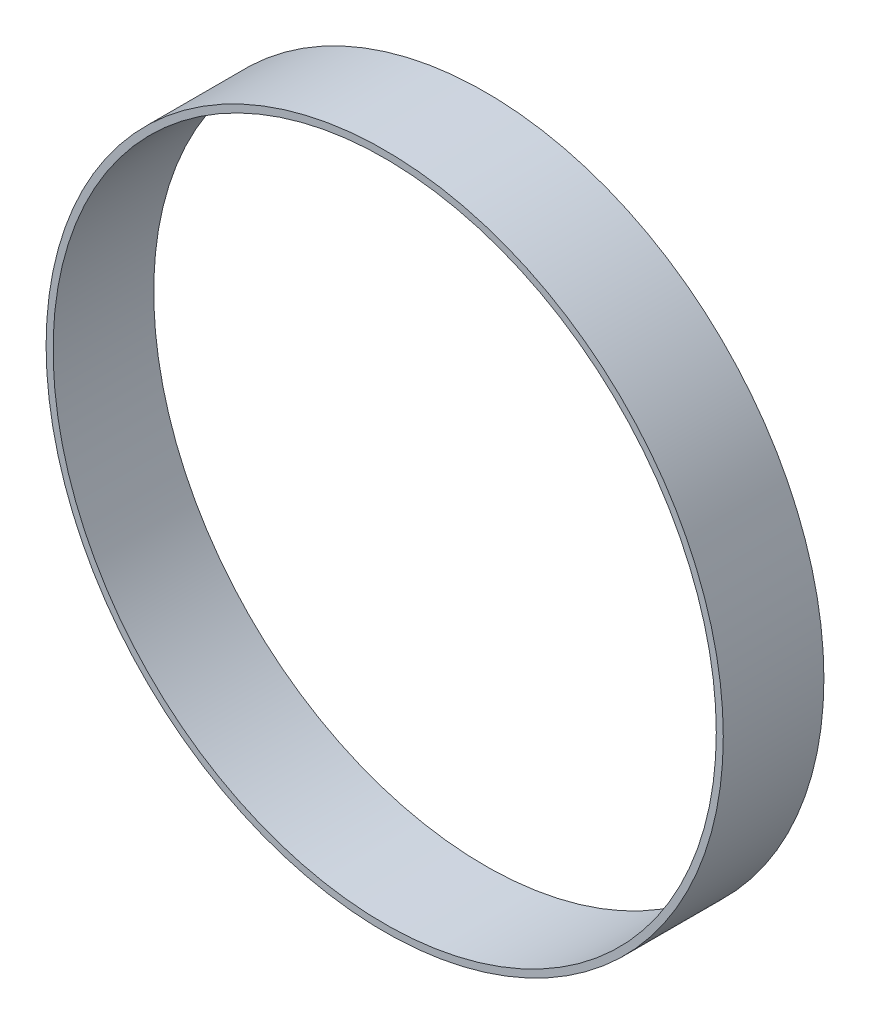
from build123d import *

# Parameters (mm, degrees)
ESQUISSE1_R        = 38.7
ESQUISSE1_R_2      = 37.9
BOSS_EXTRU_1_DEPTH = 11.5


with BuildPart() as part:
    # Esquisse1 → Boss.-Extru.1 (new body)
    with BuildSketch(Plane.XY):
        Circle(ESQUISSE1_R)
        Circle(ESQUISSE1_R_2, mode=Mode.SUBTRACT)
    extrude(amount=BOSS_EXTRU_1_DEPTH)


solid = part.part
